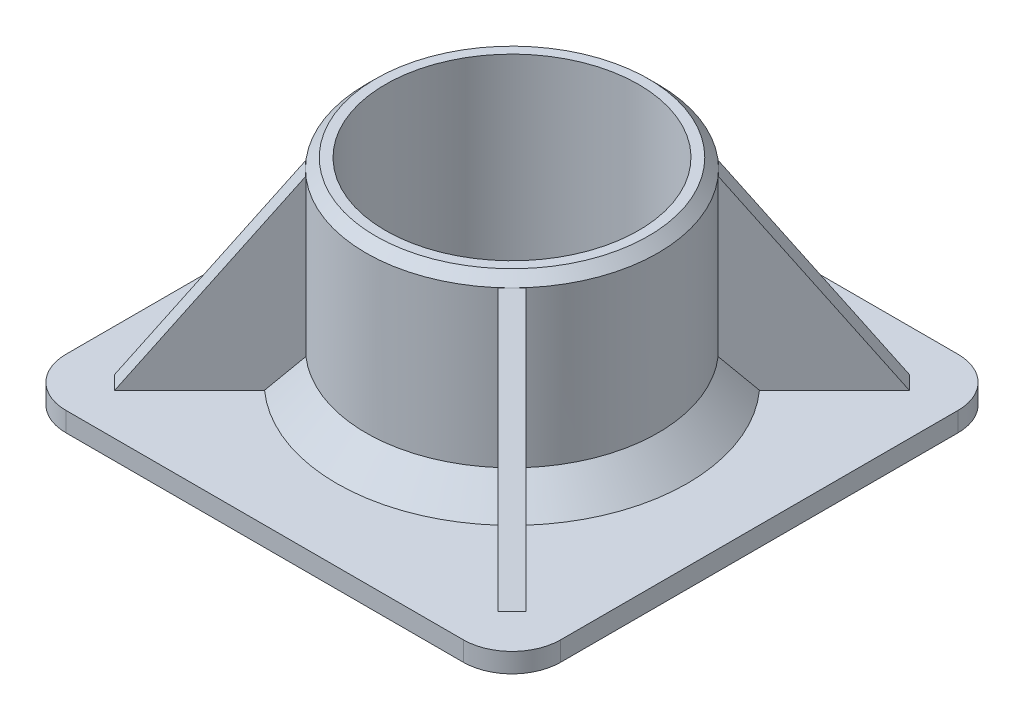
from build123d import *

# Parameters (mm, degrees)
SKETCH1_W                = 50.8
SKETCH1_H                = 50.8
BOSS_EXTRUDE1_DEPTH      = 2
SKETCH2_R                = 15
SKETCH2_R_2              = 13
BOSS_EXTRUDE2_DEPTH      = 20
CHAMFER1_SIZE            = 1
FILLET1_R                = 5
BOSS_EXTRUDE4_DEPTH      = 1
BOSS_EXTRUDE4_DEPTH_BACK = 1
BOSS_EXTRUDE5_DEPTH      = 1
BOSS_EXTRUDE5_DEPTH_BACK = 1
SKETCH7_R                = 6.35
CUT_EXTRUDE1_DEPTH       = 11
CHAMFER2_SIZE            = 3


with BuildPart() as part:
    # Sketch1 → Boss-Extrude1 (new body)
    with BuildSketch(Plane(origin=(0, 0, 0), x_dir=(1, 0, 0), z_dir=(0, 1, 0))):
        Rectangle(SKETCH1_W, SKETCH1_H)
    extrude(amount=BOSS_EXTRUDE1_DEPTH)

    # Sketch2 → Boss-Extrude2 (add)
    with BuildSketch(Plane(origin=(0, 2, 0), x_dir=(1, 0, 0), z_dir=(0, 1, 0))):
        Circle(SKETCH2_R)
        Circle(SKETCH2_R_2, mode=Mode.SUBTRACT)
    extrude(amount=BOSS_EXTRUDE2_DEPTH)

    # Chamfer1
    chamfer1_edges = [part.edges().sort_by_distance(p)[0] for p in [
        (-15, 22, 0),
    ]]
    chamfer(chamfer1_edges, length=CHAMFER1_SIZE)

    # Fillet1
    fillet1_edges = [part.edges().sort_by_distance(p)[0] for p in [
        (25.4, 1, -25.4),
        (-25.4, 1, -25.4),
        (25.4, 1, 25.4),
        (-25.4, 1, 25.4),
    ]]
    fillet(fillet1_edges, radius=FILLET1_R)

    # Sketch5 → Boss-Extrude4 (add, two sides: drawn at the far end of the back side and taken through both)
    with BuildSketch(Plane(origin=(0, 0, 0), x_dir=(-0.7071067811865476, 0, -0.7071067811865476), z_dir=(0.7071067811865476, 0, -0.7071067811865476)).offset(-BOSS_EXTRUDE4_DEPTH_BACK)):
        Polygon((-15, 21), (-28.849956672, 2), (-14.211911486, 2), (-14.211911486, 20.928757868), align=None)
        Polygon((15, 21), (28.849956672, 2), (14.236311105, 2), (14.236311105, 20.928757868), align=None)
    extrude(amount=BOSS_EXTRUDE4_DEPTH + BOSS_EXTRUDE4_DEPTH_BACK)

    # Sketch6 → Boss-Extrude5 (add, two sides: drawn at the far end of the back side and taken through both)
    with BuildSketch(Plane(origin=(0, 0, 0), x_dir=(0.7071067811865475, 0, -0.7071067811865476), z_dir=(0.7071067811865476, 0, 0.7071067811865475)).offset(-BOSS_EXTRUDE5_DEPTH_BACK)):
        Polygon((-15, 21), (-28.849956672, 2), (-14.171301729, 2), (-14.171301729, 20.395924466), align=None)
        Polygon((15, 21), (28.849956672, 2), (14.152219343, 2), (14.152219343, 20.382014455), align=None)
    extrude(amount=BOSS_EXTRUDE5_DEPTH + BOSS_EXTRUDE5_DEPTH_BACK)

    # Sketch7 → Cut-Extrude1 (cut)
    with BuildSketch(Plane(origin=(0, 2, 0), x_dir=(1, 0, 0), z_dir=(0, 1, 0))):
        with Locations((-0.199881489, -0.225905454)):
            Circle(SKETCH7_R)
    extrude(amount=-CUT_EXTRUDE1_DEPTH, mode=Mode.SUBTRACT)

    # Chamfer2
    chamfer2_edges = [part.edges().sort_by_distance(p)[0] for p in [
        (0, 2, -15),
        (15, 2, 0),
        (0, 2, 15),
        (-15, 2, 0),
    ]]
    chamfer(chamfer2_edges, length=CHAMFER2_SIZE)


solid = part.part
